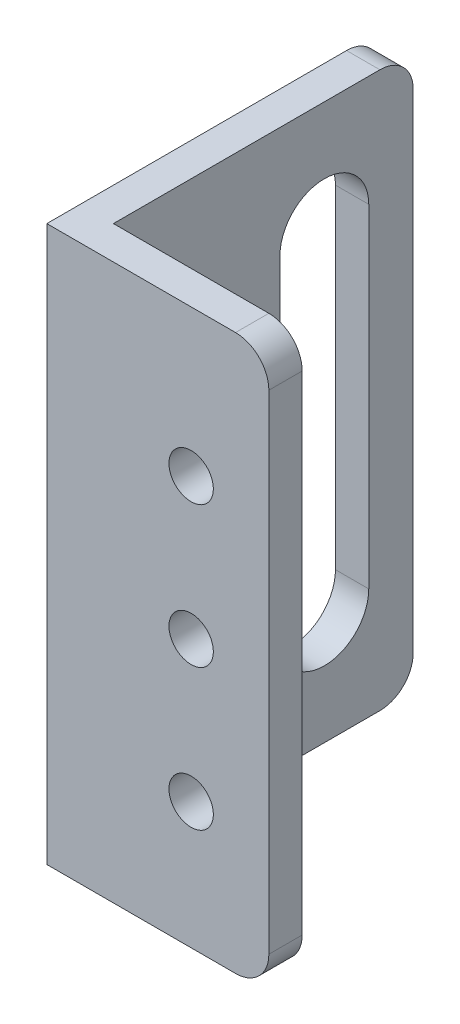
from build123d import *

# Parameters (mm, degrees)
SKETCH_1_W          = 3
SKETCH_1_H          = 27
SKETCH_1_H_2        = 3
SKETCH_1_W_2        = 17
EXTRUDE_1_DEPTH     = 50
SKETCH_2_R          = 2
CUT_EXTRUDE_1_DEPTH = 10
CUT_EXTRUDE_2_DEPTH = 10
FILLET_1_R          = 3


with BuildPart() as part:
    # 草图1 → 凸台-拉伸1 (new body)
    with BuildSketch(Plane(origin=(0, 0, 0), x_dir=(1, 0, 0), z_dir=(0, 1, 0))):
        with Locations((0, 1.5)):
            Rectangle(SKETCH_1_W, SKETCH_1_H)
        with Locations((0, -13.5)):
            Rectangle(SKETCH_1_W, SKETCH_1_H_2)
        with Locations((10, -13.5)):
            Rectangle(SKETCH_1_W_2, SKETCH_1_H_2)
    extrude(amount=EXTRUDE_1_DEPTH)

    # 草图2 → 切除-拉伸1 (cut)
    with BuildSketch(Plane.XY.offset(15)):
        with Locations((11.5, 36.8)):
            Circle(SKETCH_2_R)
        with Locations((11.5, 24.1)):
            Circle(SKETCH_2_R)
        with Locations((11.5, 11.4)):
            Circle(SKETCH_2_R)
    extrude(amount=-CUT_EXTRUDE_1_DEPTH, mode=Mode.SUBTRACT)

    # 草图3 → 切除-拉伸2 (cut)
    with BuildSketch(Plane.ZY.offset(1.5)):
        with BuildLine():
            Line((-3, 40), (-3, 10))
            ThreePointArc((-3, 10), (-7, 6), (-11, 10))
            Line((-11, 10), (-11, 40))
            ThreePointArc((-11, 40), (-7, 44), (-3, 40))
        make_face()
    extrude(amount=-CUT_EXTRUDE_2_DEPTH, mode=Mode.SUBTRACT)

    # 圆角1
    fillet_1_edges = [part.edges().sort_by_distance(p)[0] for p in [
        (18.5, 0, 13.5),
        (18.5, 50, 13.5),
        (0, 50, -15),
        (0, 0, -15),
    ]]
    fillet(fillet_1_edges, radius=FILLET_1_R)


solid = part.part
